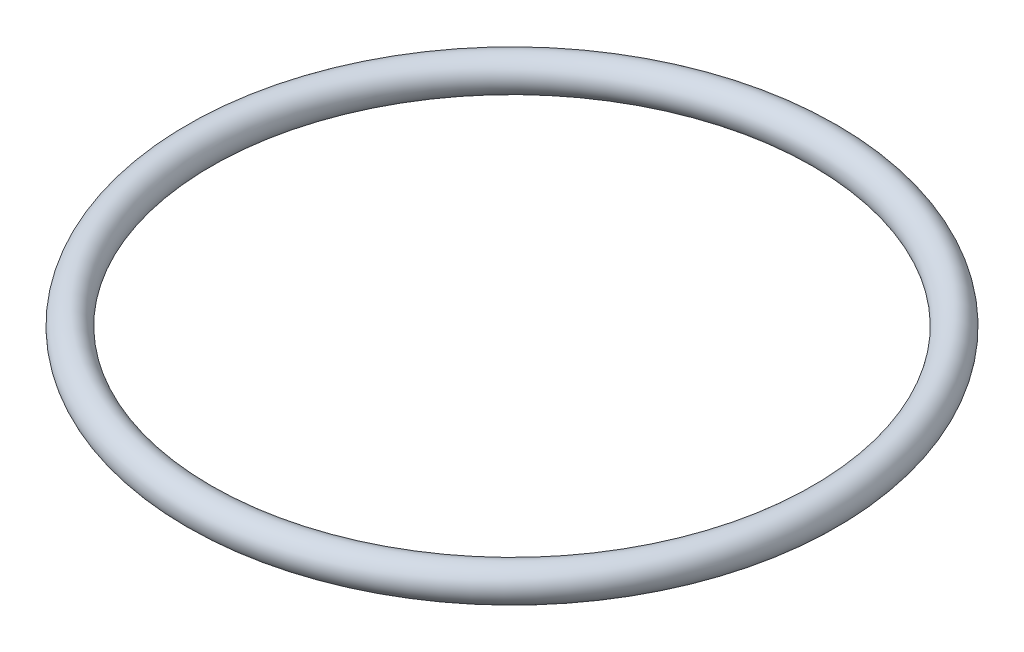
from build123d import *

# Parameters (mm, degrees)
SKETCH_1_R = 10


with BuildPart() as part:
    # 草图1 → 旋转1 (revolve)
    with BuildSketch(Plane(origin=(0, 0, 0), x_dir=(0, 0, -1), z_dir=(1, 0, 0))):
        with Locations((-185, 0)):
            Circle(SKETCH_1_R)
    revolve(axis=Axis((0, 11, 0), (0, -1, 0)))


solid = part.part
